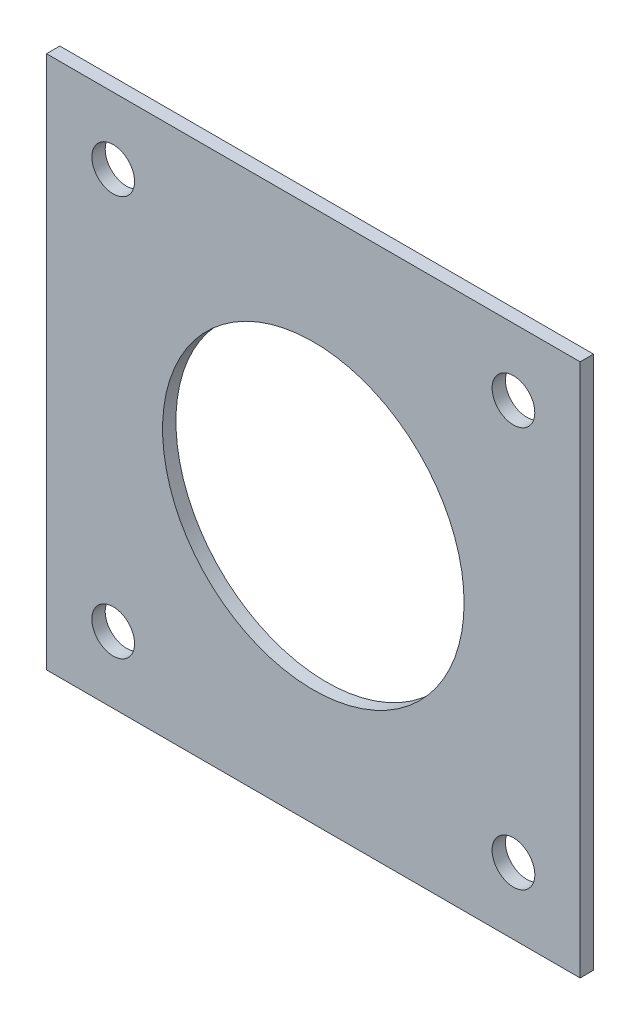
from build123d import *

# Parameters (mm, degrees)
SKETCH1_W           = 50.8
SKETCH1_H           = 50.8
SKETCH1_R           = 14.351
SKETCH1_R_2         = 2.032
BOSS_EXTRUDE1_DEPTH = 0.635


with BuildPart() as part:
    # Sketch1 → Boss-Extrude1 (new, symmetric)
    with BuildSketch(Plane.XY):
        Rectangle(SKETCH1_W, SKETCH1_H)
        Circle(SKETCH1_R, mode=Mode.SUBTRACT)
        with Locations((19.05, 19.05)):
            Circle(SKETCH1_R_2, mode=Mode.SUBTRACT)
        with Locations(Location((-19.05, 19.05, 0), (0, 0, 180))):
            Circle(SKETCH1_R_2, mode=Mode.SUBTRACT)
        with Locations(Location((19.05, -19.05, 0), (0, 0, 180))):
            Circle(SKETCH1_R_2, mode=Mode.SUBTRACT)
        with Locations((-19.05, -19.05)):
            Circle(SKETCH1_R_2, mode=Mode.SUBTRACT)
    extrude(amount=BOSS_EXTRUDE1_DEPTH, both=True)


solid = part.part
